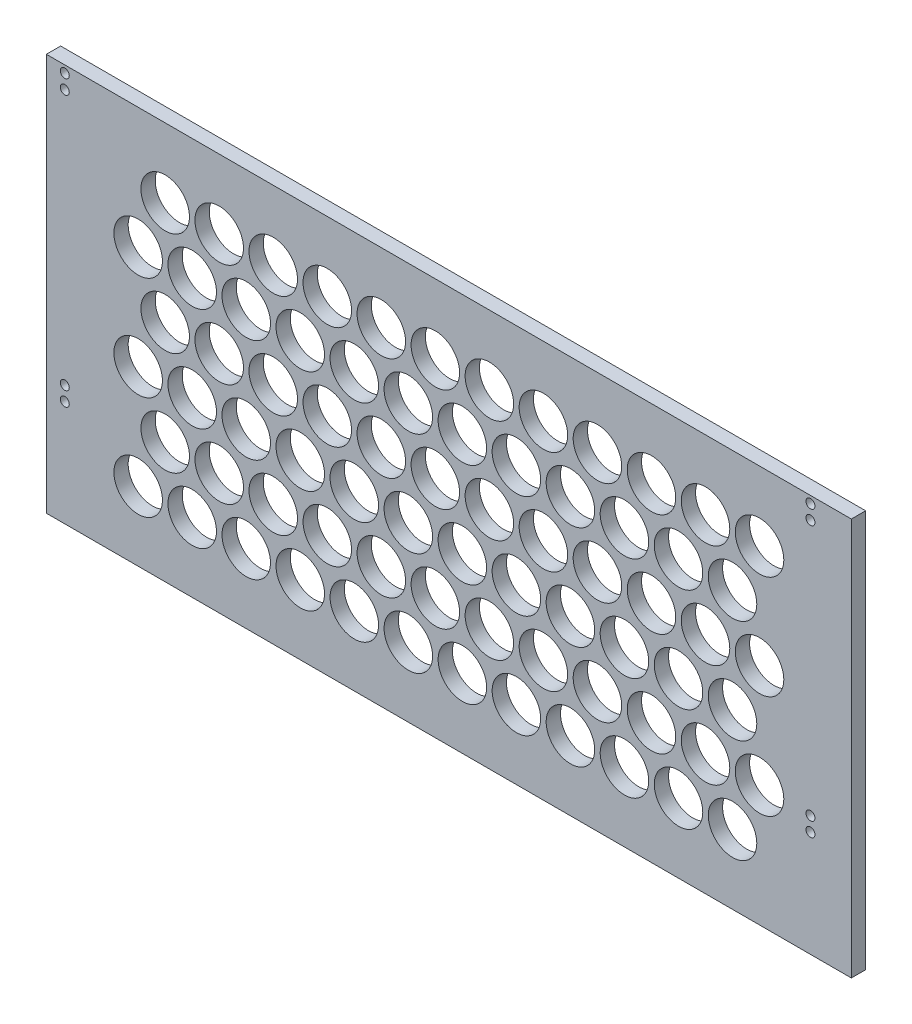
from build123d import *

# Parameters (mm, degrees)
SKETCH1_W                  = 357.55
SKETCH1_H                  = 176.55
BOSS_EXTRUDE1_DEPTH        = 6.35
SKETCH3_R                  = 10.775
CUT_EXTRUDE1_DEPTH         = 200.48257756
SKETCH4_R                  = 10.775
CUT_EXTRUDE2_DEPTH         = 200.48257756
LPATTERN1_COUNT            = 12
LPATTERN1_PITCH            = 24
LPATTERN2_COUNT            = 3
LPATTERN2_PITCH            = 46
LPATTERN2_COPY_1_SKETCH_R  = 10.775
LPATTERN2_COPY_1_DEPTH     = 200.48257756
LPATTERN2_COPY_2_SKETCH_R  = 10.775
LPATTERN2_COPY_2_DEPTH     = 200.48257756
LPATTERN2_COPY_3_SKETCH_R  = 10.775
LPATTERN2_COPY_3_DEPTH     = 200.48257756
LPATTERN2_COPY_4_SKETCH_R  = 10.775
LPATTERN2_COPY_4_DEPTH     = 200.48257756
LPATTERN2_COPY_5_SKETCH_R  = 10.775
LPATTERN2_COPY_5_DEPTH     = 200.48257756
LPATTERN2_COPY_6_SKETCH_R  = 10.775
LPATTERN2_COPY_6_DEPTH     = 200.48257756
LPATTERN2_COPY_7_SKETCH_R  = 10.775
LPATTERN2_COPY_7_DEPTH     = 200.48257756
LPATTERN2_COPY_8_SKETCH_R  = 10.775
LPATTERN2_COPY_8_DEPTH     = 200.48257756
LPATTERN2_COPY_9_SKETCH_R  = 10.775
LPATTERN2_COPY_9_DEPTH     = 200.48257756
LPATTERN2_COPY_10_SKETCH_R = 10.775
LPATTERN2_COPY_10_DEPTH    = 200.48257756
LPATTERN2_COPY_11_SKETCH_R = 10.775
LPATTERN2_COPY_11_DEPTH    = 200.48257756
LPATTERN2_COPY_12_SKETCH_R = 10.775
LPATTERN2_COPY_12_DEPTH    = 200.48257756
LPATTERN2_COPY_13_SKETCH_R = 10.775
LPATTERN2_COPY_13_DEPTH    = 200.48257756
LPATTERN2_COPY_14_SKETCH_R = 10.775
LPATTERN2_COPY_14_DEPTH    = 200.48257756
LPATTERN2_COPY_15_SKETCH_R = 10.775
LPATTERN2_COPY_15_DEPTH    = 200.48257756
LPATTERN2_COPY_16_SKETCH_R = 10.775
LPATTERN2_COPY_16_DEPTH    = 200.48257756
LPATTERN2_COPY_17_SKETCH_R = 10.775
LPATTERN2_COPY_17_DEPTH    = 200.48257756
LPATTERN2_COPY_18_SKETCH_R = 10.775
LPATTERN2_COPY_18_DEPTH    = 200.48257756
LPATTERN2_COPY_19_SKETCH_R = 10.775
LPATTERN2_COPY_19_DEPTH    = 200.48257756
LPATTERN2_COPY_20_SKETCH_R = 10.775
LPATTERN2_COPY_20_DEPTH    = 200.48257756
LPATTERN2_COPY_21_SKETCH_R = 10.775
LPATTERN2_COPY_21_DEPTH    = 200.48257756
LPATTERN2_COPY_22_SKETCH_R = 10.775
LPATTERN2_COPY_22_DEPTH    = 200.48257756
LPATTERN2_COPY_23_SKETCH_R = 10.775
LPATTERN2_COPY_23_DEPTH    = 200.48257756
LPATTERN2_COPY_24_SKETCH_R = 10.775
LPATTERN2_COPY_24_DEPTH    = 200.48257756
LPATTERN2_COPY_25_SKETCH_R = 10.775
LPATTERN2_COPY_25_DEPTH    = 200.48257756
LPATTERN2_COPY_26_SKETCH_R = 10.775
LPATTERN2_COPY_26_DEPTH    = 200.48257756
LPATTERN2_COPY_27_SKETCH_R = 10.775
LPATTERN2_COPY_27_DEPTH    = 200.48257756
LPATTERN2_COPY_28_SKETCH_R = 10.775
LPATTERN2_COPY_28_DEPTH    = 200.48257756
LPATTERN2_COPY_29_SKETCH_R = 10.775
LPATTERN2_COPY_29_DEPTH    = 200.48257756
LPATTERN2_COPY_30_SKETCH_R = 10.775
LPATTERN2_COPY_30_DEPTH    = 200.48257756
LPATTERN2_COPY_31_SKETCH_R = 10.775
LPATTERN2_COPY_31_DEPTH    = 200.48257756
LPATTERN2_COPY_32_SKETCH_R = 10.775
LPATTERN2_COPY_32_DEPTH    = 200.48257756
LPATTERN2_COPY_33_SKETCH_R = 10.775
LPATTERN2_COPY_33_DEPTH    = 200.48257756
LPATTERN2_COPY_34_SKETCH_R = 10.775
LPATTERN2_COPY_34_DEPTH    = 200.48257756
LPATTERN2_COPY_35_SKETCH_R = 10.775
LPATTERN2_COPY_35_DEPTH    = 200.48257756
LPATTERN2_COPY_36_SKETCH_R = 10.775
LPATTERN2_COPY_36_DEPTH    = 200.48257756
LPATTERN2_COPY_37_SKETCH_R = 10.775
LPATTERN2_COPY_37_DEPTH    = 200.48257756
LPATTERN2_COPY_38_SKETCH_R = 10.775
LPATTERN2_COPY_38_DEPTH    = 200.48257756
LPATTERN2_COPY_39_SKETCH_R = 10.775
LPATTERN2_COPY_39_DEPTH    = 200.48257756
LPATTERN2_COPY_40_SKETCH_R = 10.775
LPATTERN2_COPY_40_DEPTH    = 200.48257756
LPATTERN2_COPY_41_SKETCH_R = 10.775
LPATTERN2_COPY_41_DEPTH    = 200.48257756
LPATTERN2_COPY_42_SKETCH_R = 10.775
LPATTERN2_COPY_42_DEPTH    = 200.48257756
LPATTERN2_COPY_43_SKETCH_R = 10.775
LPATTERN2_COPY_43_DEPTH    = 200.48257756
LPATTERN2_COPY_44_SKETCH_R = 10.775
LPATTERN2_COPY_44_DEPTH    = 200.48257756
SKETCH5_R                  = 2
CUT_EXTRUDE3_DEPTH         = 200.48257756


with BuildPart() as part:
    # Sketch1 → Boss-Extrude1 (new body)
    with BuildSketch(Plane.XY):
        Rectangle(SKETCH1_W, SKETCH1_H)
    extrude(amount=BOSS_EXTRUDE1_DEPTH)

    # Sketch3 → Cut-Extrude1 (cut, through all)
    with BuildSketch(Plane.XY.offset(6.35)):
        with Locations((-138, -57.5)):
            Circle(SKETCH3_R)
    cut_extrude1 = extrude(amount=-CUT_EXTRUDE1_DEPTH, mode=Mode.SUBTRACT)

    # Sketch4 → Cut-Extrude2 (cut, through all)
    with BuildSketch(Plane.XY.offset(6.35)):
        with Locations((-126, -34.5)):
            Circle(SKETCH4_R)
    cut_extrude2 = extrude(amount=-CUT_EXTRUDE2_DEPTH, mode=Mode.SUBTRACT)

    # LPattern1: Cut-Extrude1, Cut-Extrude2 ×12
    with Locations(*[(i * LPATTERN1_PITCH, 0, 0) for i in range(1, LPATTERN1_COUNT)]):
        add(cut_extrude1, mode=Mode.SUBTRACT)
        add(cut_extrude2, mode=Mode.SUBTRACT)

    # LPattern2: Cut-Extrude1, Cut-Extrude2 ×3
    with Locations(*[(0, i * LPATTERN2_PITCH, 0) for i in range(1, LPATTERN2_COUNT)]):
        add(cut_extrude1, mode=Mode.SUBTRACT)
        add(cut_extrude2, mode=Mode.SUBTRACT)

    # LPattern2 copy 1 sketch → LPattern2 copy 1 (cut, through all)
    with BuildSketch(Plane(origin=(24, 46, 6.35), x_dir=(1, 0, 0), z_dir=(0, 0, 1))):
        with Locations((-138, -57.5)):
            Circle(LPATTERN2_COPY_1_SKETCH_R)
    extrude(amount=-LPATTERN2_COPY_1_DEPTH, mode=Mode.SUBTRACT)

    # LPattern2 copy 2 sketch → LPattern2 copy 2 (cut, through all)
    with BuildSketch(Plane(origin=(24, 92, 6.35), x_dir=(1, 0, 0), z_dir=(0, 0, 1))):
        with Locations((-138, -57.5)):
            Circle(LPATTERN2_COPY_2_SKETCH_R)
    extrude(amount=-LPATTERN2_COPY_2_DEPTH, mode=Mode.SUBTRACT)

    # LPattern2 copy 3 sketch → LPattern2 copy 3 (cut, through all)
    with BuildSketch(Plane(origin=(48, 46, 6.35), x_dir=(1, 0, 0), z_dir=(0, 0, 1))):
        with Locations((-138, -57.5)):
            Circle(LPATTERN2_COPY_3_SKETCH_R)
    extrude(amount=-LPATTERN2_COPY_3_DEPTH, mode=Mode.SUBTRACT)

    # LPattern2 copy 4 sketch → LPattern2 copy 4 (cut, through all)
    with BuildSketch(Plane(origin=(48, 92, 6.35), x_dir=(1, 0, 0), z_dir=(0, 0, 1))):
        with Locations((-138, -57.5)):
            Circle(LPATTERN2_COPY_4_SKETCH_R)
    extrude(amount=-LPATTERN2_COPY_4_DEPTH, mode=Mode.SUBTRACT)

    # LPattern2 copy 5 sketch → LPattern2 copy 5 (cut, through all)
    with BuildSketch(Plane(origin=(72, 46, 6.35), x_dir=(1, 0, 0), z_dir=(0, 0, 1))):
        with Locations((-138, -57.5)):
            Circle(LPATTERN2_COPY_5_SKETCH_R)
    extrude(amount=-LPATTERN2_COPY_5_DEPTH, mode=Mode.SUBTRACT)

    # LPattern2 copy 6 sketch → LPattern2 copy 6 (cut, through all)
    with BuildSketch(Plane(origin=(72, 92, 6.35), x_dir=(1, 0, 0), z_dir=(0, 0, 1))):
        with Locations((-138, -57.5)):
            Circle(LPATTERN2_COPY_6_SKETCH_R)
    extrude(amount=-LPATTERN2_COPY_6_DEPTH, mode=Mode.SUBTRACT)

    # LPattern2 copy 7 sketch → LPattern2 copy 7 (cut, through all)
    with BuildSketch(Plane(origin=(96, 46, 6.35), x_dir=(1, 0, 0), z_dir=(0, 0, 1))):
        with Locations((-138, -57.5)):
            Circle(LPATTERN2_COPY_7_SKETCH_R)
    extrude(amount=-LPATTERN2_COPY_7_DEPTH, mode=Mode.SUBTRACT)

    # LPattern2 copy 8 sketch → LPattern2 copy 8 (cut, through all)
    with BuildSketch(Plane(origin=(96, 92, 6.35), x_dir=(1, 0, 0), z_dir=(0, 0, 1))):
        with Locations((-138, -57.5)):
            Circle(LPATTERN2_COPY_8_SKETCH_R)
    extrude(amount=-LPATTERN2_COPY_8_DEPTH, mode=Mode.SUBTRACT)

    # LPattern2 copy 9 sketch → LPattern2 copy 9 (cut, through all)
    with BuildSketch(Plane(origin=(120, 46, 6.35), x_dir=(1, 0, 0), z_dir=(0, 0, 1))):
        with Locations((-138, -57.5)):
            Circle(LPATTERN2_COPY_9_SKETCH_R)
    extrude(amount=-LPATTERN2_COPY_9_DEPTH, mode=Mode.SUBTRACT)

    # LPattern2 copy 10 sketch → LPattern2 copy 10 (cut, through all)
    with BuildSketch(Plane(origin=(120, 92, 6.35), x_dir=(1, 0, 0), z_dir=(0, 0, 1))):
        with Locations((-138, -57.5)):
            Circle(LPATTERN2_COPY_10_SKETCH_R)
    extrude(amount=-LPATTERN2_COPY_10_DEPTH, mode=Mode.SUBTRACT)

    # LPattern2 copy 11 sketch → LPattern2 copy 11 (cut, through all)
    with BuildSketch(Plane(origin=(144, 46, 6.35), x_dir=(1, 0, 0), z_dir=(0, 0, 1))):
        with Locations((-138, -57.5)):
            Circle(LPATTERN2_COPY_11_SKETCH_R)
    extrude(amount=-LPATTERN2_COPY_11_DEPTH, mode=Mode.SUBTRACT)

    # LPattern2 copy 12 sketch → LPattern2 copy 12 (cut, through all)
    with BuildSketch(Plane(origin=(144, 92, 6.35), x_dir=(1, 0, 0), z_dir=(0, 0, 1))):
        with Locations((-138, -57.5)):
            Circle(LPATTERN2_COPY_12_SKETCH_R)
    extrude(amount=-LPATTERN2_COPY_12_DEPTH, mode=Mode.SUBTRACT)

    # LPattern2 copy 13 sketch → LPattern2 copy 13 (cut, through all)
    with BuildSketch(Plane(origin=(168, 46, 6.35), x_dir=(1, 0, 0), z_dir=(0, 0, 1))):
        with Locations((-138, -57.5)):
            Circle(LPATTERN2_COPY_13_SKETCH_R)
    extrude(amount=-LPATTERN2_COPY_13_DEPTH, mode=Mode.SUBTRACT)

    # LPattern2 copy 14 sketch → LPattern2 copy 14 (cut, through all)
    with BuildSketch(Plane(origin=(168, 92, 6.35), x_dir=(1, 0, 0), z_dir=(0, 0, 1))):
        with Locations((-138, -57.5)):
            Circle(LPATTERN2_COPY_14_SKETCH_R)
    extrude(amount=-LPATTERN2_COPY_14_DEPTH, mode=Mode.SUBTRACT)

    # LPattern2 copy 15 sketch → LPattern2 copy 15 (cut, through all)
    with BuildSketch(Plane(origin=(192, 46, 6.35), x_dir=(1, 0, 0), z_dir=(0, 0, 1))):
        with Locations((-138, -57.5)):
            Circle(LPATTERN2_COPY_15_SKETCH_R)
    extrude(amount=-LPATTERN2_COPY_15_DEPTH, mode=Mode.SUBTRACT)

    # LPattern2 copy 16 sketch → LPattern2 copy 16 (cut, through all)
    with BuildSketch(Plane(origin=(192, 92, 6.35), x_dir=(1, 0, 0), z_dir=(0, 0, 1))):
        with Locations((-138, -57.5)):
            Circle(LPATTERN2_COPY_16_SKETCH_R)
    extrude(amount=-LPATTERN2_COPY_16_DEPTH, mode=Mode.SUBTRACT)

    # LPattern2 copy 17 sketch → LPattern2 copy 17 (cut, through all)
    with BuildSketch(Plane(origin=(216, 46, 6.35), x_dir=(1, 0, 0), z_dir=(0, 0, 1))):
        with Locations((-138, -57.5)):
            Circle(LPATTERN2_COPY_17_SKETCH_R)
    extrude(amount=-LPATTERN2_COPY_17_DEPTH, mode=Mode.SUBTRACT)

    # LPattern2 copy 18 sketch → LPattern2 copy 18 (cut, through all)
    with BuildSketch(Plane(origin=(216, 92, 6.35), x_dir=(1, 0, 0), z_dir=(0, 0, 1))):
        with Locations((-138, -57.5)):
            Circle(LPATTERN2_COPY_18_SKETCH_R)
    extrude(amount=-LPATTERN2_COPY_18_DEPTH, mode=Mode.SUBTRACT)

    # LPattern2 copy 19 sketch → LPattern2 copy 19 (cut, through all)
    with BuildSketch(Plane(origin=(240, 46, 6.35), x_dir=(1, 0, 0), z_dir=(0, 0, 1))):
        with Locations((-138, -57.5)):
            Circle(LPATTERN2_COPY_19_SKETCH_R)
    extrude(amount=-LPATTERN2_COPY_19_DEPTH, mode=Mode.SUBTRACT)

    # LPattern2 copy 20 sketch → LPattern2 copy 20 (cut, through all)
    with BuildSketch(Plane(origin=(240, 92, 6.35), x_dir=(1, 0, 0), z_dir=(0, 0, 1))):
        with Locations((-138, -57.5)):
            Circle(LPATTERN2_COPY_20_SKETCH_R)
    extrude(amount=-LPATTERN2_COPY_20_DEPTH, mode=Mode.SUBTRACT)

    # LPattern2 copy 21 sketch → LPattern2 copy 21 (cut, through all)
    with BuildSketch(Plane(origin=(264, 46, 6.35), x_dir=(1, 0, 0), z_dir=(0, 0, 1))):
        with Locations((-138, -57.5)):
            Circle(LPATTERN2_COPY_21_SKETCH_R)
    extrude(amount=-LPATTERN2_COPY_21_DEPTH, mode=Mode.SUBTRACT)

    # LPattern2 copy 22 sketch → LPattern2 copy 22 (cut, through all)
    with BuildSketch(Plane(origin=(264, 92, 6.35), x_dir=(1, 0, 0), z_dir=(0, 0, 1))):
        with Locations((-138, -57.5)):
            Circle(LPATTERN2_COPY_22_SKETCH_R)
    extrude(amount=-LPATTERN2_COPY_22_DEPTH, mode=Mode.SUBTRACT)

    # LPattern2 copy 23 sketch → LPattern2 copy 23 (cut, through all)
    with BuildSketch(Plane(origin=(24, 46, 6.35), x_dir=(1, 0, 0), z_dir=(0, 0, 1))):
        with Locations((-126, -34.5)):
            Circle(LPATTERN2_COPY_23_SKETCH_R)
    extrude(amount=-LPATTERN2_COPY_23_DEPTH, mode=Mode.SUBTRACT)

    # LPattern2 copy 24 sketch → LPattern2 copy 24 (cut, through all)
    with BuildSketch(Plane(origin=(24, 92, 6.35), x_dir=(1, 0, 0), z_dir=(0, 0, 1))):
        with Locations((-126, -34.5)):
            Circle(LPATTERN2_COPY_24_SKETCH_R)
    extrude(amount=-LPATTERN2_COPY_24_DEPTH, mode=Mode.SUBTRACT)

    # LPattern2 copy 25 sketch → LPattern2 copy 25 (cut, through all)
    with BuildSketch(Plane(origin=(48, 46, 6.35), x_dir=(1, 0, 0), z_dir=(0, 0, 1))):
        with Locations((-126, -34.5)):
            Circle(LPATTERN2_COPY_25_SKETCH_R)
    extrude(amount=-LPATTERN2_COPY_25_DEPTH, mode=Mode.SUBTRACT)

    # LPattern2 copy 26 sketch → LPattern2 copy 26 (cut, through all)
    with BuildSketch(Plane(origin=(48, 92, 6.35), x_dir=(1, 0, 0), z_dir=(0, 0, 1))):
        with Locations((-126, -34.5)):
            Circle(LPATTERN2_COPY_26_SKETCH_R)
    extrude(amount=-LPATTERN2_COPY_26_DEPTH, mode=Mode.SUBTRACT)

    # LPattern2 copy 27 sketch → LPattern2 copy 27 (cut, through all)
    with BuildSketch(Plane(origin=(72, 46, 6.35), x_dir=(1, 0, 0), z_dir=(0, 0, 1))):
        with Locations((-126, -34.5)):
            Circle(LPATTERN2_COPY_27_SKETCH_R)
    extrude(amount=-LPATTERN2_COPY_27_DEPTH, mode=Mode.SUBTRACT)

    # LPattern2 copy 28 sketch → LPattern2 copy 28 (cut, through all)
    with BuildSketch(Plane(origin=(72, 92, 6.35), x_dir=(1, 0, 0), z_dir=(0, 0, 1))):
        with Locations((-126, -34.5)):
            Circle(LPATTERN2_COPY_28_SKETCH_R)
    extrude(amount=-LPATTERN2_COPY_28_DEPTH, mode=Mode.SUBTRACT)

    # LPattern2 copy 29 sketch → LPattern2 copy 29 (cut, through all)
    with BuildSketch(Plane(origin=(96, 46, 6.35), x_dir=(1, 0, 0), z_dir=(0, 0, 1))):
        with Locations((-126, -34.5)):
            Circle(LPATTERN2_COPY_29_SKETCH_R)
    extrude(amount=-LPATTERN2_COPY_29_DEPTH, mode=Mode.SUBTRACT)

    # LPattern2 copy 30 sketch → LPattern2 copy 30 (cut, through all)
    with BuildSketch(Plane(origin=(96, 92, 6.35), x_dir=(1, 0, 0), z_dir=(0, 0, 1))):
        with Locations((-126, -34.5)):
            Circle(LPATTERN2_COPY_30_SKETCH_R)
    extrude(amount=-LPATTERN2_COPY_30_DEPTH, mode=Mode.SUBTRACT)

    # LPattern2 copy 31 sketch → LPattern2 copy 31 (cut, through all)
    with BuildSketch(Plane(origin=(120, 46, 6.35), x_dir=(1, 0, 0), z_dir=(0, 0, 1))):
        with Locations((-126, -34.5)):
            Circle(LPATTERN2_COPY_31_SKETCH_R)
    extrude(amount=-LPATTERN2_COPY_31_DEPTH, mode=Mode.SUBTRACT)

    # LPattern2 copy 32 sketch → LPattern2 copy 32 (cut, through all)
    with BuildSketch(Plane(origin=(120, 92, 6.35), x_dir=(1, 0, 0), z_dir=(0, 0, 1))):
        with Locations((-126, -34.5)):
            Circle(LPATTERN2_COPY_32_SKETCH_R)
    extrude(amount=-LPATTERN2_COPY_32_DEPTH, mode=Mode.SUBTRACT)

    # LPattern2 copy 33 sketch → LPattern2 copy 33 (cut, through all)
    with BuildSketch(Plane(origin=(144, 46, 6.35), x_dir=(1, 0, 0), z_dir=(0, 0, 1))):
        with Locations((-126, -34.5)):
            Circle(LPATTERN2_COPY_33_SKETCH_R)
    extrude(amount=-LPATTERN2_COPY_33_DEPTH, mode=Mode.SUBTRACT)

    # LPattern2 copy 34 sketch → LPattern2 copy 34 (cut, through all)
    with BuildSketch(Plane(origin=(144, 92, 6.35), x_dir=(1, 0, 0), z_dir=(0, 0, 1))):
        with Locations((-126, -34.5)):
            Circle(LPATTERN2_COPY_34_SKETCH_R)
    extrude(amount=-LPATTERN2_COPY_34_DEPTH, mode=Mode.SUBTRACT)

    # LPattern2 copy 35 sketch → LPattern2 copy 35 (cut, through all)
    with BuildSketch(Plane(origin=(168, 46, 6.35), x_dir=(1, 0, 0), z_dir=(0, 0, 1))):
        with Locations((-126, -34.5)):
            Circle(LPATTERN2_COPY_35_SKETCH_R)
    extrude(amount=-LPATTERN2_COPY_35_DEPTH, mode=Mode.SUBTRACT)

    # LPattern2 copy 36 sketch → LPattern2 copy 36 (cut, through all)
    with BuildSketch(Plane(origin=(168, 92, 6.35), x_dir=(1, 0, 0), z_dir=(0, 0, 1))):
        with Locations((-126, -34.5)):
            Circle(LPATTERN2_COPY_36_SKETCH_R)
    extrude(amount=-LPATTERN2_COPY_36_DEPTH, mode=Mode.SUBTRACT)

    # LPattern2 copy 37 sketch → LPattern2 copy 37 (cut, through all)
    with BuildSketch(Plane(origin=(192, 46, 6.35), x_dir=(1, 0, 0), z_dir=(0, 0, 1))):
        with Locations((-126, -34.5)):
            Circle(LPATTERN2_COPY_37_SKETCH_R)
    extrude(amount=-LPATTERN2_COPY_37_DEPTH, mode=Mode.SUBTRACT)

    # LPattern2 copy 38 sketch → LPattern2 copy 38 (cut, through all)
    with BuildSketch(Plane(origin=(192, 92, 6.35), x_dir=(1, 0, 0), z_dir=(0, 0, 1))):
        with Locations((-126, -34.5)):
            Circle(LPATTERN2_COPY_38_SKETCH_R)
    extrude(amount=-LPATTERN2_COPY_38_DEPTH, mode=Mode.SUBTRACT)

    # LPattern2 copy 39 sketch → LPattern2 copy 39 (cut, through all)
    with BuildSketch(Plane(origin=(216, 46, 6.35), x_dir=(1, 0, 0), z_dir=(0, 0, 1))):
        with Locations((-126, -34.5)):
            Circle(LPATTERN2_COPY_39_SKETCH_R)
    extrude(amount=-LPATTERN2_COPY_39_DEPTH, mode=Mode.SUBTRACT)

    # LPattern2 copy 40 sketch → LPattern2 copy 40 (cut, through all)
    with BuildSketch(Plane(origin=(216, 92, 6.35), x_dir=(1, 0, 0), z_dir=(0, 0, 1))):
        with Locations((-126, -34.5)):
            Circle(LPATTERN2_COPY_40_SKETCH_R)
    extrude(amount=-LPATTERN2_COPY_40_DEPTH, mode=Mode.SUBTRACT)

    # LPattern2 copy 41 sketch → LPattern2 copy 41 (cut, through all)
    with BuildSketch(Plane(origin=(240, 46, 6.35), x_dir=(1, 0, 0), z_dir=(0, 0, 1))):
        with Locations((-126, -34.5)):
            Circle(LPATTERN2_COPY_41_SKETCH_R)
    extrude(amount=-LPATTERN2_COPY_41_DEPTH, mode=Mode.SUBTRACT)

    # LPattern2 copy 42 sketch → LPattern2 copy 42 (cut, through all)
    with BuildSketch(Plane(origin=(240, 92, 6.35), x_dir=(1, 0, 0), z_dir=(0, 0, 1))):
        with Locations((-126, -34.5)):
            Circle(LPATTERN2_COPY_42_SKETCH_R)
    extrude(amount=-LPATTERN2_COPY_42_DEPTH, mode=Mode.SUBTRACT)

    # LPattern2 copy 43 sketch → LPattern2 copy 43 (cut, through all)
    with BuildSketch(Plane(origin=(264, 46, 6.35), x_dir=(1, 0, 0), z_dir=(0, 0, 1))):
        with Locations((-126, -34.5)):
            Circle(LPATTERN2_COPY_43_SKETCH_R)
    extrude(amount=-LPATTERN2_COPY_43_DEPTH, mode=Mode.SUBTRACT)

    # LPattern2 copy 44 sketch → LPattern2 copy 44 (cut, through all)
    with BuildSketch(Plane(origin=(264, 92, 6.35), x_dir=(1, 0, 0), z_dir=(0, 0, 1))):
        with Locations((-126, -34.5)):
            Circle(LPATTERN2_COPY_44_SKETCH_R)
    extrude(amount=-LPATTERN2_COPY_44_DEPTH, mode=Mode.SUBTRACT)

    # Sketch5 → Cut-Extrude3 (cut, through all)
    with BuildSketch(Plane(origin=(0, 0, 0), x_dir=(-1, 0, 0), z_dir=(0, 0, -1))):
        with Locations((170.59999995, 85.1)):
            Circle(SKETCH5_R)
        with Locations((170.59999995, 78.75)):
            Circle(SKETCH5_R)
        with Locations((170.59999995, -34.9)):
            Circle(SKETCH5_R)
        with Locations((170.59999995, -41.25)):
            Circle(SKETCH5_R)
        with Locations((-160.59999995, 85.1)):
            Circle(SKETCH5_R)
        with Locations((-160.59999995, 78.75)):
            Circle(SKETCH5_R)
        with Locations((-160.59999995, -34.9)):
            Circle(SKETCH5_R)
        with Locations((-160.59999995, -41.25)):
            Circle(SKETCH5_R)
    extrude(amount=-CUT_EXTRUDE3_DEPTH, mode=Mode.SUBTRACT)


solid = part.part
